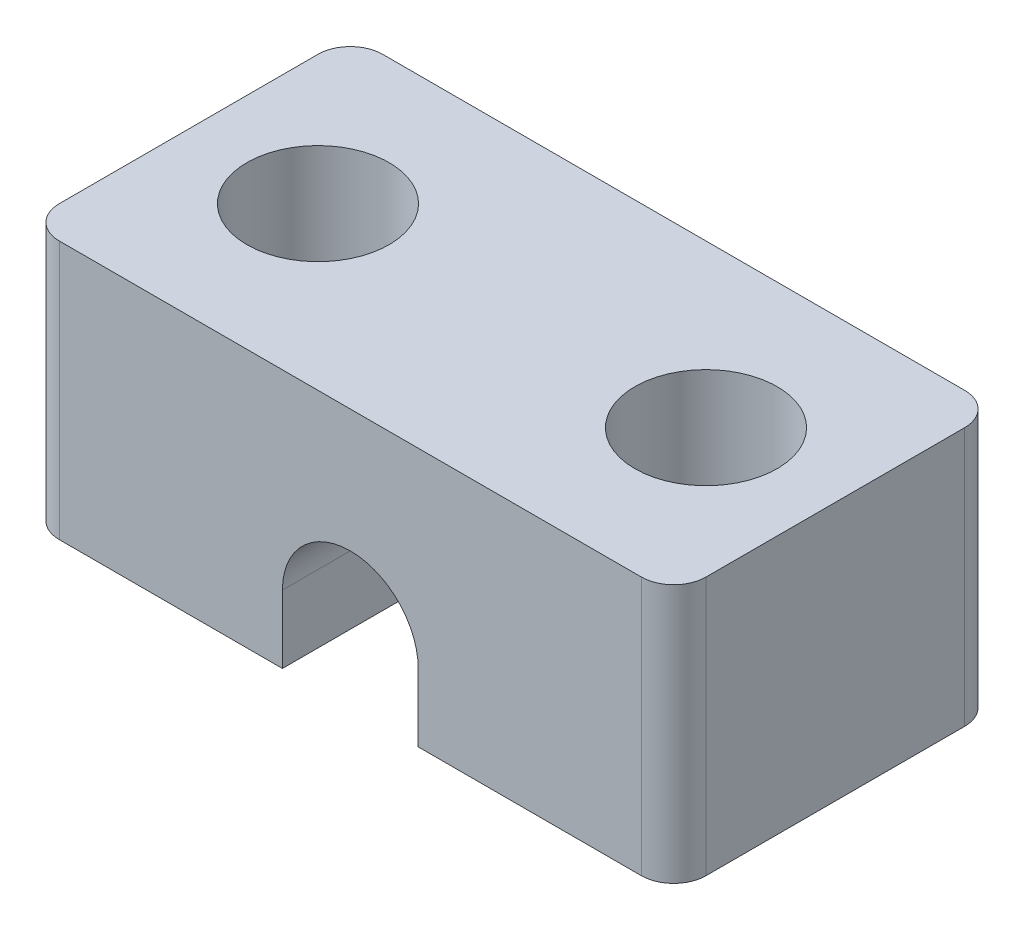
from build123d import *

# Parameters (mm, degrees)
EXTRUDE_1_DEPTH     = 5
SKETCH_2_R          = 2.2
CUT_EXTRUDE_1_DEPTH = 14.747727085
EXTRUDE_START       = -5.8
EXTRUDE_2_DEPTH     = 5.8
FILLET_1_R          = 1


with BuildPart() as part:
    # 草图1 → 凸台-拉伸1 (new, symmetric)
    with BuildSketch(Plane.XY):
        with BuildLine():
            Line((2.1, -2.1), (10, -2.1))
            Line((10, -2.1), (10, 5.9))
            Line((10, 5.9), (-10, 5.9))
            Line((-10, 5.9), (-10, -2.1))
            Line((-10, -2.1), (-2.1, -2.1))
            Line((-2.1, -2.1), (-2.1, 0))
            ThreePointArc((-2.1, 0), (0, 2.1), (2.1, 0))
            Line((2.1, 0), (2.1, -2.1))
        make_face()
    extrude(amount=EXTRUDE_1_DEPTH, both=True)

    # 草图2 → 切除-拉伸1 (cut, through all)
    with BuildSketch(Plane(origin=(0, 5.9, 0), x_dir=(1, 0, 0), z_dir=(0, 1, 0))):
        with Locations(Location((-6, 0, 0), (0, 0, 270))):
            Circle(SKETCH_2_R)
        with Locations(Location((6, 0, 0), (0, 0, 270))):
            Circle(SKETCH_2_R)
    extrude(amount=-CUT_EXTRUDE_1_DEPTH, mode=Mode.SUBTRACT)

    # 草图3 → 凸台-拉伸2 (add)
    with BuildSketch(Plane(origin=(0, 0, -5), x_dir=(-1, 0, 0), z_dir=(0, 0, -1)).offset(EXTRUDE_START)):
        with BuildLine():
            Line((2.1, -2.1), (2.1, 0))
            ThreePointArc((2.1, 0), (0, 2.1), (-2.1, 0))
            Line((-2.1, 0), (-2.1, -2.1))
            Line((-2.1, -2.1), (2.1, -2.1))
        make_face()
    extrude(amount=EXTRUDE_2_DEPTH)

    # 圆角1
    fillet_1_edges = [part.edges().sort_by_distance(p)[0] for p in [
        (-10, 1.9, -5),
        (10, 1.9, 5),
        (-10, 1.9, 5),
        (10, 1.9, -5),
    ]]
    fillet(fillet_1_edges, radius=FILLET_1_R)


solid = part.part
